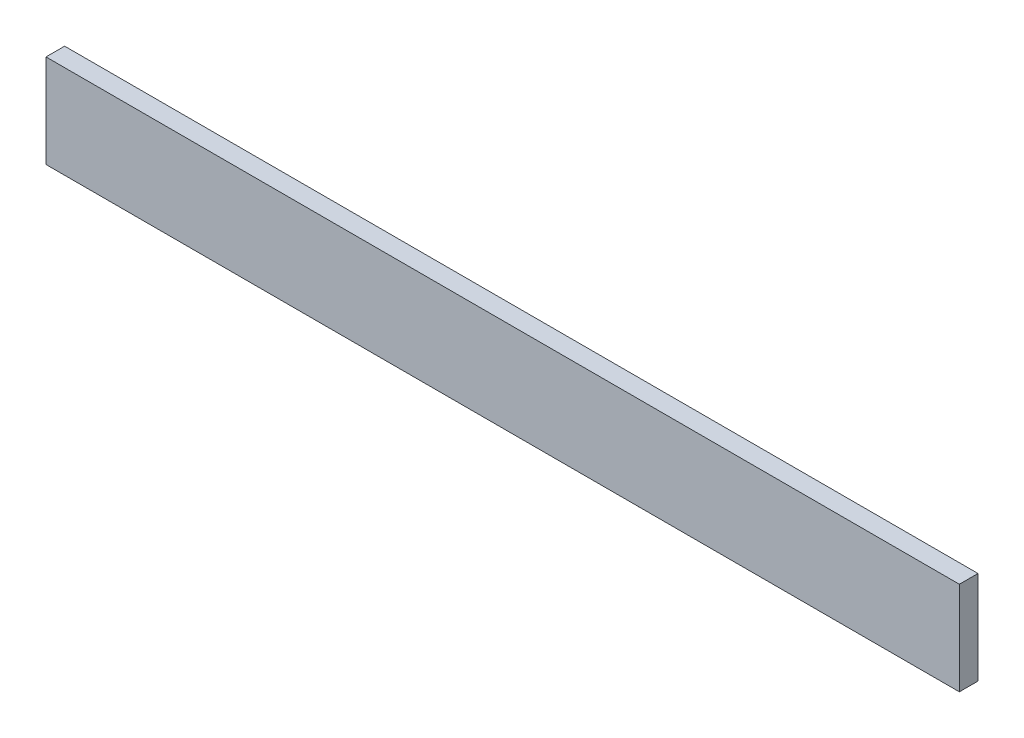
from build123d import *

# Parameters (mm, degrees)
SKIZZE1_W                       = 147
SKIZZE1_H                       = 15
AUFSATZ_LINEAR_AUSTRAGEN1_DEPTH = 3


with BuildPart() as part:
    # Skizze1 → Aufsatz-Linear austragen1 (new body)
    with BuildSketch(Plane.XY):
        Rectangle(SKIZZE1_W, SKIZZE1_H)
    extrude(amount=AUFSATZ_LINEAR_AUSTRAGEN1_DEPTH)


solid = part.part
